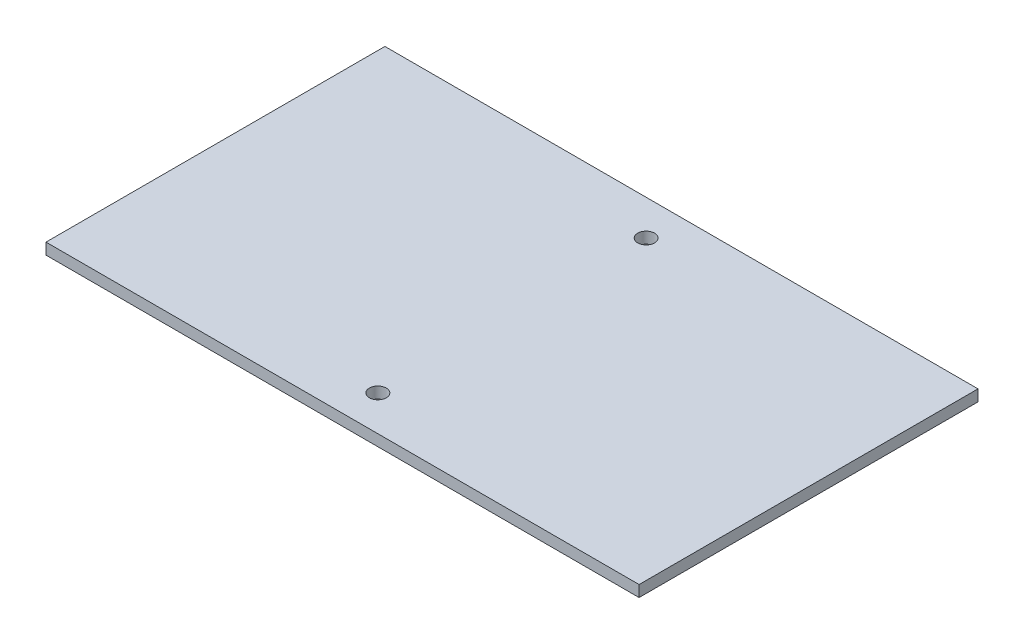
from build123d import *

# Parameters (mm, degrees)
SKETCH1_W           = 210
SKETCH1_H           = 120
BOSS_EXTRUDE3_DEPTH = 4
SKETCH5_R           = 3
CUT_EXTRUDE1_DEPTH  = 10


with BuildPart() as part:
    # Sketch1 → Boss-Extrude3 (new body)
    with BuildSketch(Plane(origin=(0, 0, 0), x_dir=(1, 0, 0), z_dir=(0, 1, 0))):
        Rectangle(SKETCH1_W, SKETCH1_H)
    extrude(amount=BOSS_EXTRUDE3_DEPTH)

    # Sketch5 → Cut-Extrude1 (cut)
    with BuildSketch(Plane(origin=(0, 4, 0), x_dir=(1, 0, 0), z_dir=(0, 1, 0))):
        with Locations(Location((0, 47.5, 0), (0, 0, 270))):
            Circle(SKETCH5_R)
        with Locations(Location((0, -47.5, 0), (0, 0, 270))):
            Circle(SKETCH5_R)
    extrude(amount=-CUT_EXTRUDE1_DEPTH, mode=Mode.SUBTRACT)


solid = part.part
